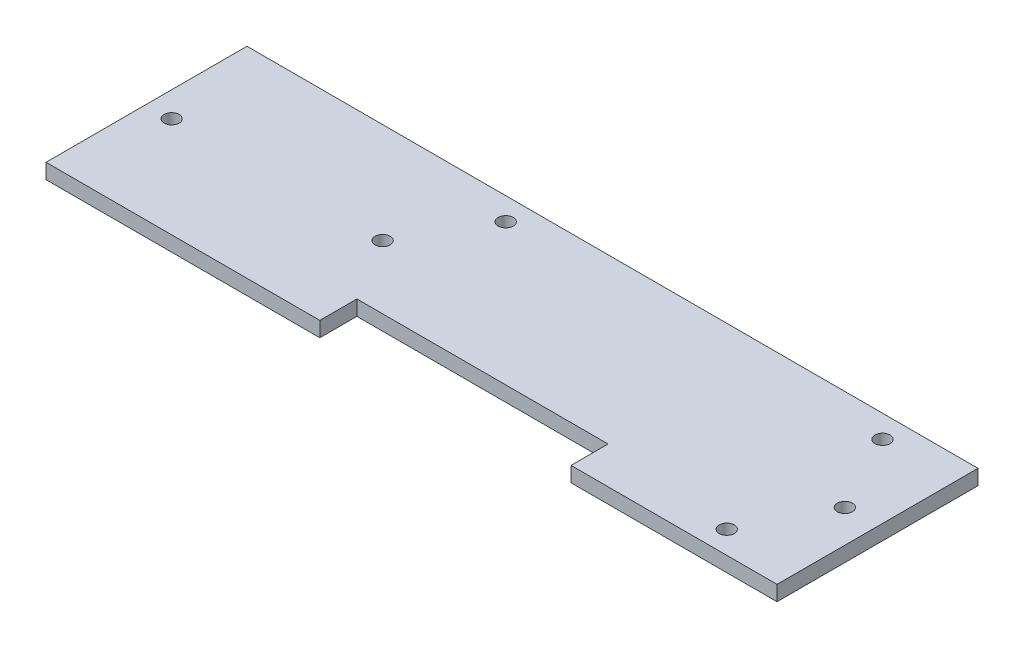
from build123d import *

# Parameters (mm, degrees)
SKETCH1_R           = 1.5
BOSS_EXTRUDE1_DEPTH = 3


with BuildPart() as part:
    # Sketch1 → Boss-Extrude1 (new body)
    with BuildSketch(Plane(origin=(0, 0, 0), x_dir=(1, 0, 0), z_dir=(0, 1, 0))):
        Polygon((145.508062677, 0), (0, 0), (0, -40), (54.5, -40), (54.5, -35.5), (54.5, -32.62019756), (104.5, -32.62019756), (104.5, -40), (145.508062677, -40), align=None)
        with Locations(Location((131, -35.5, 0), (0, 0, 270))):
            Circle(SKETCH1_R, mode=Mode.SUBTRACT)
        with Locations(Location((5, -20, 0), (0, 0, 270))):
            Circle(SKETCH1_R, mode=Mode.SUBTRACT)
        with Locations(Location((47, -20, 0), (0, 0, 270))):
            Circle(SKETCH1_R, mode=Mode.SUBTRACT)
        with Locations(Location((56, -4.5, 0), (0, 0, 270))):
            Circle(SKETCH1_R, mode=Mode.SUBTRACT)
        with Locations(Location((139, -20, 0), (0, 0, 270))):
            Circle(SKETCH1_R, mode=Mode.SUBTRACT)
        with Locations(Location((131, -4.5, 0), (0, 0, 270))):
            Circle(SKETCH1_R, mode=Mode.SUBTRACT)
    extrude(amount=BOSS_EXTRUDE1_DEPTH)


solid = part.part
